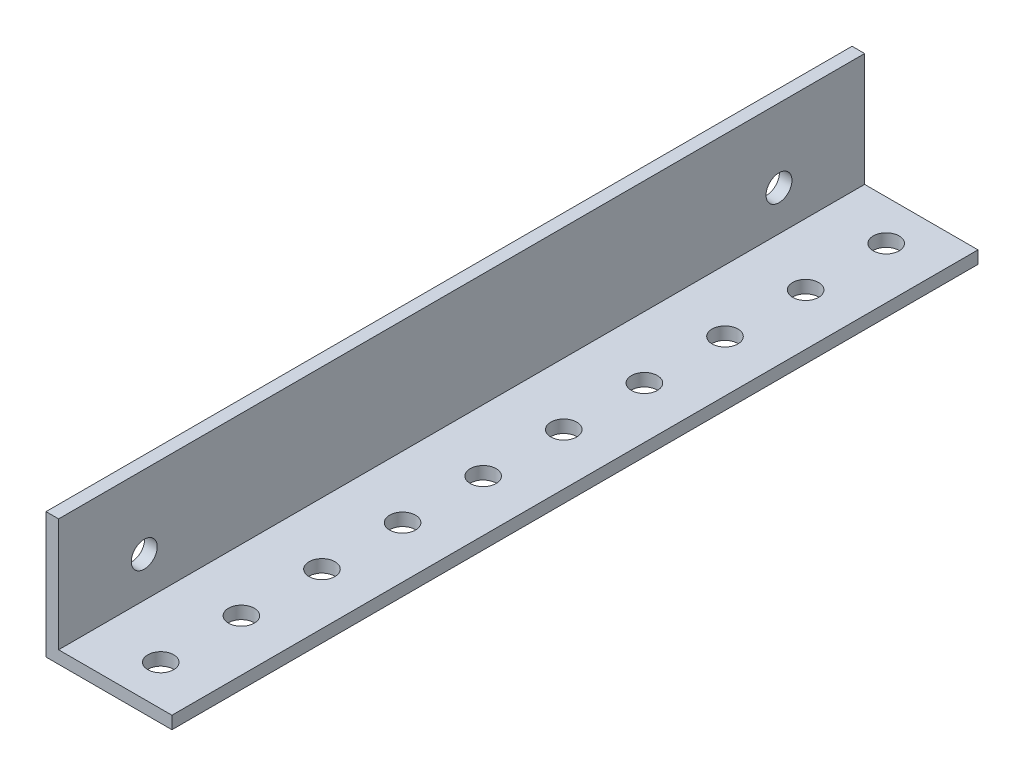
from build123d import *

# Parameters (mm, degrees)
EXTRUDE1_DEPTH            = 50.8
LPATTERN1_COUNT           = 10
LPATTERN1_PITCH           = 10.16
F_4_CLEARANCE_HOLE2_D     = 3.2639
F_4_CLEARANCE_HOLE2_DEPTH = 15.24
F_4_CLEARANCE_HOLE2_TIP   = 0.980574487


with BuildPart() as part:
    # Sketch1 → Extrude1 (new, symmetric)
    with BuildSketch(Plane.XY):
        Polygon((0, 0), (0, 15.875), (1.5875, 15.875), (1.5875, 1.5875), (15.875, 1.5875), (15.875, 0), align=None)
    extrude(amount=EXTRUDE1_DEPTH, both=True)

    # Sketch3 → #4 Clearance Hole1 (revolve, cut)
    with BuildSketch(Plane(origin=(9.3853, 1.5875, -45.72), x_dir=(0, 0, 1), z_dir=(1, 0, 0))):
        Polygon((0, 0), (0, 16.220574487), (1.63195, 15.24), (1.63195, 0), align=None)
    f_4_clearance_hole1 = revolve(axis=Axis((9.3853, 7.9375, -45.72), (0, -1, 0)), mode=Mode.SUBTRACT)

    # LPattern1: #4 Clearance Hole1 ×10
    with Locations(*[(0, 0, i * LPATTERN1_PITCH) for i in range(1, LPATTERN1_COUNT)]):
        add(f_4_clearance_hole1, mode=Mode.SUBTRACT)

    # #4 Clearance Hole2
    with Locations(Plane(origin=(1.5875, 6.62178, -40.005), x_dir=(0, 1, 0), z_dir=(1, 0, 0))):
        with Locations((0, 0), (0, 80.01)):
            Hole(F_4_CLEARANCE_HOLE2_D / 2, depth=F_4_CLEARANCE_HOLE2_DEPTH)
            with Locations((0, 0, -(F_4_CLEARANCE_HOLE2_DEPTH + F_4_CLEARANCE_HOLE2_TIP / 2))):  # 118° drill point
                Cone(0, F_4_CLEARANCE_HOLE2_D / 2, F_4_CLEARANCE_HOLE2_TIP, mode=Mode.SUBTRACT)


solid = part.part
